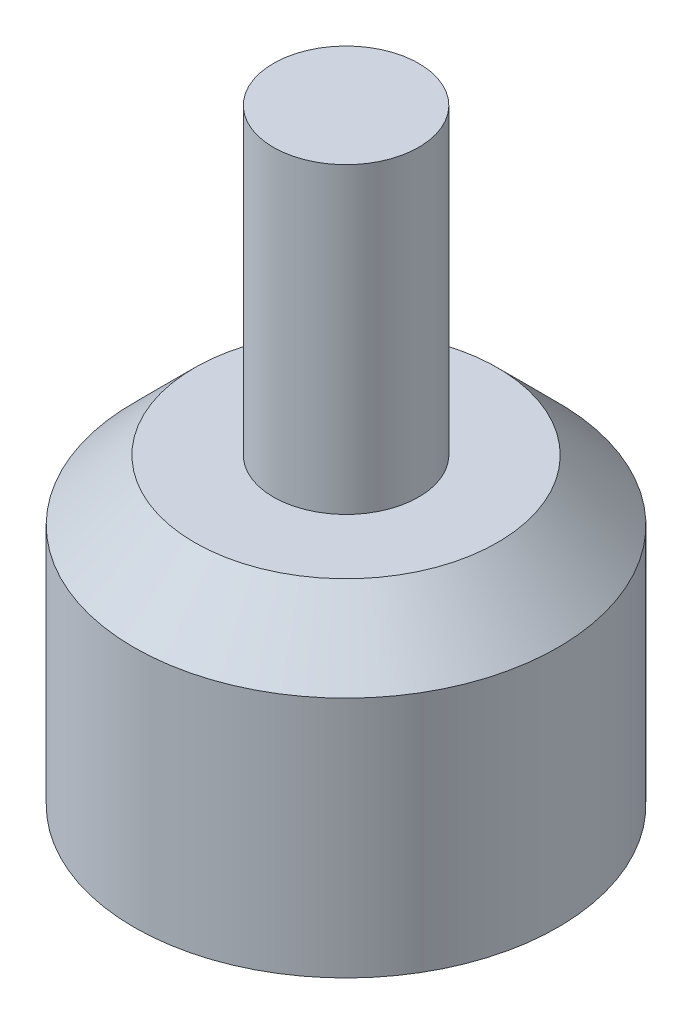
from build123d import *

# Parameters (mm, degrees)
SKETCH1_R           = 7
BOSS_EXTRUDE1_DEPTH = 10
CHAMFER1_SIZE       = 2
SKETCH2_R           = 2.4
BOSS_EXTRUDE2_DEPTH = 10


with BuildPart() as part:
    # Sketch1 → Boss-Extrude1 (new body)
    with BuildSketch(Plane(origin=(0, 0, 0), x_dir=(1, 0, 0), z_dir=(0, 1, 0))):
        with Locations(Location((0, 0, 0), (0, 0, 270))):
            Circle(SKETCH1_R)
    extrude(amount=BOSS_EXTRUDE1_DEPTH)

    # Chamfer1
    chamfer1_edges = [part.edges().sort_by_distance(p)[0] for p in [
        (0, 10, -7),
    ]]
    chamfer(chamfer1_edges, length=CHAMFER1_SIZE)

    # Sketch2 → Boss-Extrude2 (add)
    with BuildSketch(Plane(origin=(0, 10, 0), x_dir=(1, 0, 0), z_dir=(0, 1, 0))):
        with Locations(Location((0, 0, 0), (0, 0, 270))):
            Circle(SKETCH2_R)
    extrude(amount=BOSS_EXTRUDE2_DEPTH)


solid = part.part
